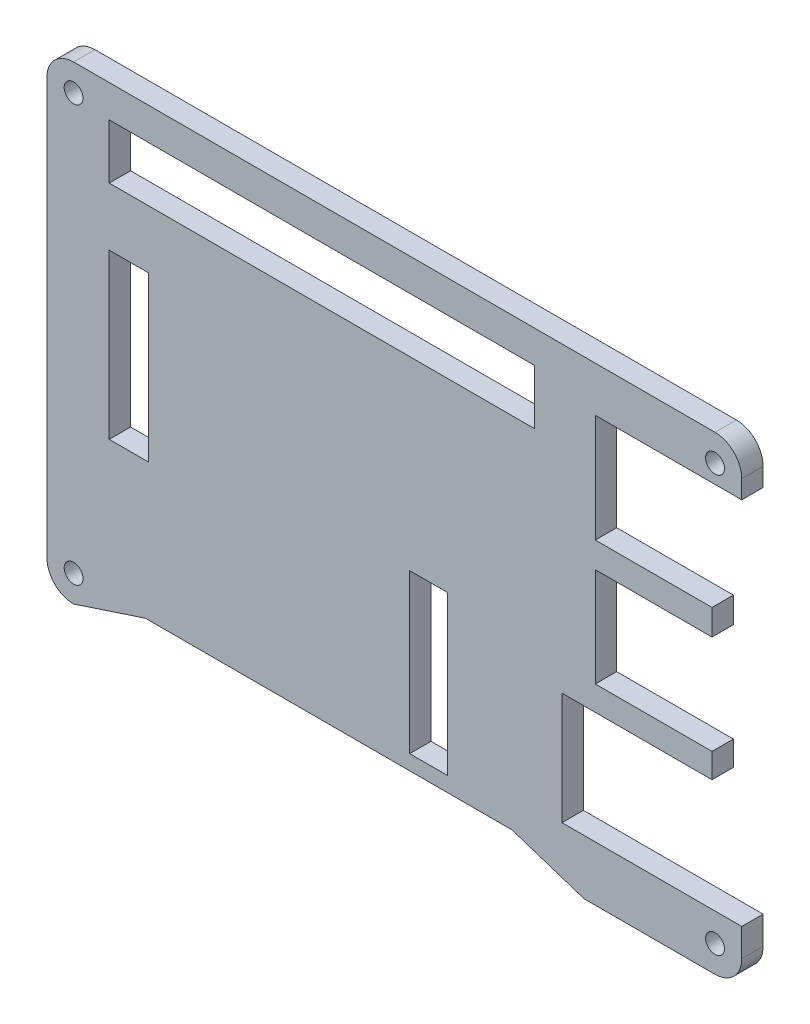
from build123d import *

# Parameters (mm, degrees)
SKETCH1_R           = 1.3462
SKETCH1_W           = 5.4034
SKETCH1_H           = 22.6066
SKETCH1_W_2         = 60.6932
SKETCH1_H_2         = 7.81
SKETCH1_W_3         = 5.588
SKETCH1_H_3         = 23.368
BOSS_EXTRUDE1_DEPTH = 3.048


with BuildPart() as part:
    # Sketch1 → Boss-Extrude1 (new body)
    with BuildSketch(Plane.XY):
        with BuildLine():
            Line((57.404932375, 30.507694304), (-34.084892625, 30.507694304))
            ThreePointArc((-34.084892625, 30.507694304), (-36.778969461, 29.391771141), (-37.894892625, 26.697694304))
            Line((-37.894892625, 26.697694304), (-37.894892625, -32.641005696))
            ThreePointArc((-37.894892625, -32.641005696), (-36.778969461, -35.335082532), (-34.084892625, -36.451005696))
            Line((-34.084892625, -36.451005696), (-23.844892625, -33.084405696))
            Line((-23.844892625, -33.084405696), (28.474307375, -33.084405696))
            Line((28.474307375, -33.084405696), (38.714307375, -36.451005696))
            Line((38.714307375, -36.451005696), (57.405007375, -36.451005696))
            ThreePointArc((57.405007375, -36.451005696), (60.108826144, -35.325305244), (61.214907375, -32.613401529))
            Line((61.214907375, -32.613401529), (61.214907375, -28.627805696))
            Line((61.214907375, -28.627805696), (35.575007375, -28.627805696))
            Line((35.575007375, -28.627805696), (35.575007375, -12.628005696))
            Line((35.575007375, -12.628005696), (56.975007375, -12.628005696))
            Line((56.975007375, -12.628005696), (56.975007375, -9.121805696))
            Line((56.975007375, -9.121805696), (40.325007375, -9.121805696))
            Line((40.325007375, -9.121805696), (40.325007375, 4.997894304))
            Line((40.325007375, 4.997894304), (56.975007375, 4.997894304))
            Line((56.975007375, 4.997894304), (56.975007375, 8.658194304))
            Line((56.975007375, 8.658194304), (40.325007375, 8.658194304))
            Line((40.325007375, 8.658194304), (40.325007375, 24.068294304))
            Line((40.325007375, 24.068294304), (61.214907375, 24.068294304))
            Line((61.214907375, 24.068294304), (61.214907375, 26.683892153))
            ThreePointArc((61.214907375, 26.683892153), (60.103884597, 29.386886916), (57.404932375, 30.507694304))
        make_face()
        with Locations(Location((57.405007375, -32.641005696, 0), (0, 0, 180))):
            Circle(SKETCH1_R, mode=Mode.SUBTRACT)
        with Locations(Location((-34.084892625, -32.641005696, 0), (0, 0, 180))):
            Circle(SKETCH1_R, mode=Mode.SUBTRACT)
        with Locations(Location((-34.084892625, 26.697694304, 0), (0, 0, 180))):
            Circle(SKETCH1_R, mode=Mode.SUBTRACT)
        with Locations(Location((57.404932375, 26.697694304, 0), (0, 0, 180))):
            Circle(SKETCH1_R, mode=Mode.SUBTRACT)
        with Locations((16.546707375, -19.663505696)):
            Rectangle(SKETCH1_W, SKETCH1_H, mode=Mode.SUBTRACT)
        with Locations((1.341707375, 21.991994304)):
            Rectangle(SKETCH1_W_2, SKETCH1_H_2, mode=Mode.SUBTRACT)
        with Locations((-26.210892625, -1.882805696)):
            Rectangle(SKETCH1_W_3, SKETCH1_H_3, mode=Mode.SUBTRACT)
    extrude(amount=BOSS_EXTRUDE1_DEPTH)


solid = part.part
